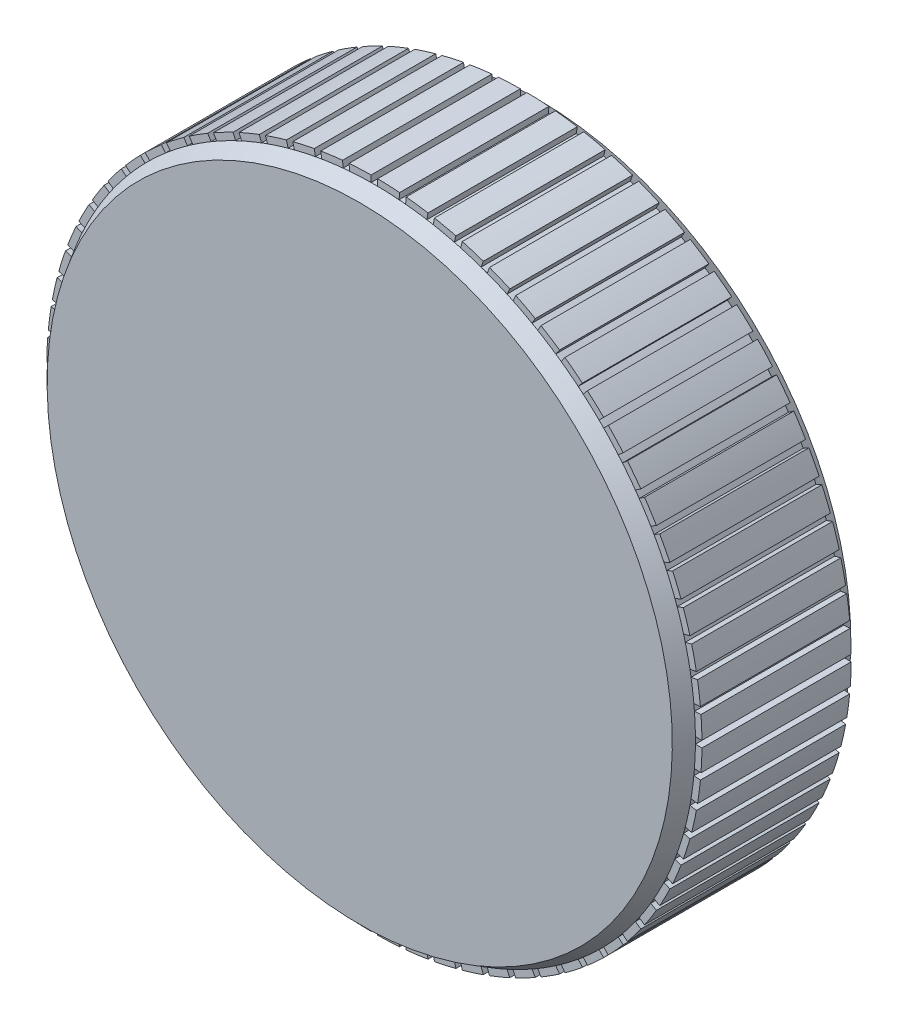
from build123d import *

# Parameters (mm, degrees)
SKETCH1_R               = 3.175
EXTRUDE1_DEPTH          = 3.175
SKETCH21_R              = 12.7
BOSS_EXTRUDE1_DEPTH     = 7.9375
SKETCH34_R              = 12.7
SKETCH34_R_2            = 7.14375
CUT_EXTRUDE4_DEPTH      = 1.016
CUT_EXTRUDE1_REACH      = 31.487
CUT_EXTRUDE1_END_RADIUS = 12.7
SKETCH22_W              = 0.254
SKETCH22_H              = 7.9375
CIRPATTERN1_COUNT       = 72
CHAMFER3_SIZE           = 0.381
SKETCH35_R              = 4.7625
SKETCH35_R_2            = 2.413
CUT_EXTRUDE5_DEPTH      = 5.3975
SKETCH36_R              = 2.413
CUT_EXTRUDE6_DEPTH      = 3.8735


with BuildPart() as part:
    # Sketch1 → Extrude1 (new body)
    with BuildSketch(Plane.XY):
        Circle(SKETCH1_R)
    extrude(amount=EXTRUDE1_DEPTH)

    # Sketch21 → Boss-Extrude1 (add)
    with BuildSketch(Plane.XY):
        with Locations(Location((0, 0, 0), (0, 0, 180))):
            Circle(SKETCH21_R)
    extrude(amount=BOSS_EXTRUDE1_DEPTH)

    # Sketch34 → Cut-Extrude4 (cut)
    with BuildSketch(Plane(origin=(0, 0, 0), x_dir=(-1, 0, 0), z_dir=(0, 0, -1))):
        Circle(SKETCH34_R)
        Circle(SKETCH34_R_2, mode=Mode.SUBTRACT)
    extrude(amount=-CUT_EXTRUDE4_DEPTH, mode=Mode.SUBTRACT)

    # Cut-Extrude1: up to this cylinder (the profile starts outside it)
    cut_extrude1_end = Plane(origin=(0, -0.254, 3.96875), z_dir=(0, 0, -1)) * Cylinder(CUT_EXTRUDE1_END_RADIUS, 89.374, mode=Mode.PRIVATE)
    # Sketch22 → Cut-Extrude1 (cut, up to the surface)
    with BuildSketch(Plane(origin=(0, 12.7, 0), x_dir=(-1, 0, 0), z_dir=(0, 1, 0)), mode=Mode.PRIVATE) as cut_extrude1_sk1:
        with Locations((0, 3.96875)):
            Rectangle(SKETCH22_W, SKETCH22_H)
    cut_extrude1_tool1 = extrude(cut_extrude1_sk1.sketch, amount=-CUT_EXTRUDE1_REACH, mode=Mode.PRIVATE) - cut_extrude1_end
    cut_extrude1 = cut_extrude1_tool1.solids().sort_by_distance((0, 12.7, 3.96875))[0]
    add(cut_extrude1, mode=Mode.SUBTRACT)

    # CirPattern1: Cut-Extrude1 ×72 about axis
    cirpattern1_axis = Axis((0, 0, 0), (0, 0, 1))
    for i in range(1, CIRPATTERN1_COUNT):
        add(cut_extrude1.rotate(cirpattern1_axis, i * 360 / CIRPATTERN1_COUNT), mode=Mode.SUBTRACT)

    # Sketch29 → Cut-Revolve1 (revolve, cut)
    with BuildSketch(Plane(origin=(0, 0, 0), x_dir=(0, 0, -1), z_dir=(1, 0, 0))):
        Polygon((-7.370535714, 12.446), (-7.9375, 12.118663017), (-7.9375, 12.954), (-7.370535714, 12.954), align=None)
        Polygon((-1.016, 12.954), (-1.582964286, 12.954), (-1.582964286, 12.446), (-1.016, 12.118663017), align=None)
    revolve(axis=Axis((0, 0, 0), (0, 0, 1)), mode=Mode.SUBTRACT)

    # Chamfer3
    chamfer3_edges = [part.edges().sort_by_distance(p)[0] for p in [
        (7.14375, 0, 0),
    ]]
    chamfer(chamfer3_edges, length=CHAMFER3_SIZE)

    # Sketch35 → Cut-Extrude5 (cut)
    with BuildSketch(Plane.XY):
        Circle(SKETCH35_R)
        Circle(SKETCH35_R_2, mode=Mode.SUBTRACT)
    extrude(amount=CUT_EXTRUDE5_DEPTH, mode=Mode.SUBTRACT)

    # Sketch36 → Cut-Extrude6 (cut)
    with BuildSketch(Plane(origin=(0, 0, 0), x_dir=(-1, 0, 0), z_dir=(0, 0, -1))):
        with Locations(Location((0, 0, 0), (0, 0, 180))):
            Circle(SKETCH36_R)
    extrude(amount=-CUT_EXTRUDE6_DEPTH, mode=Mode.SUBTRACT)


solid = part.part
